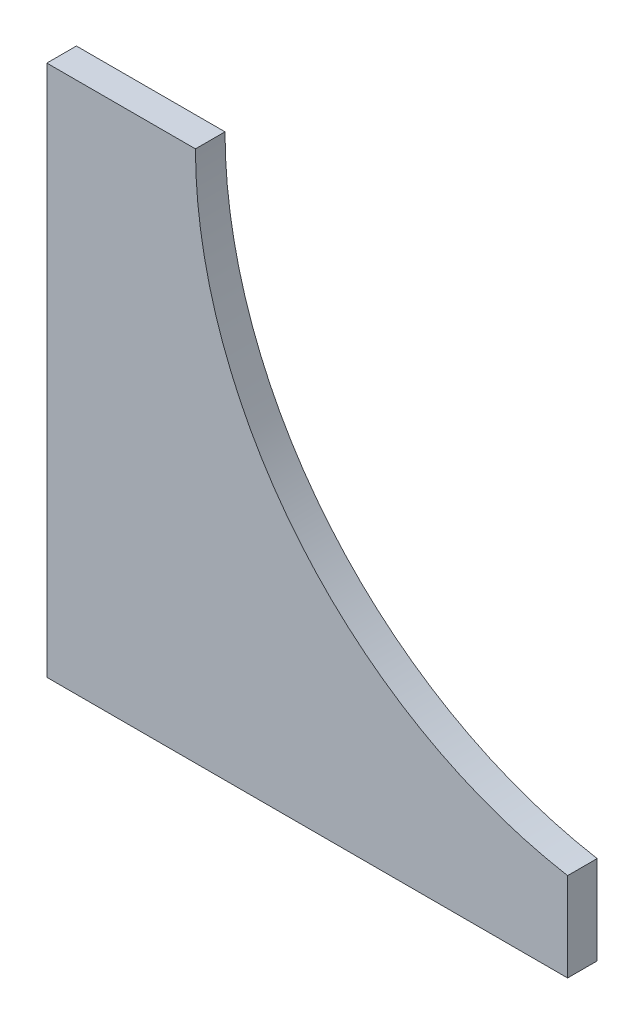
from build123d import *

# Parameters (mm, degrees)
SALIENTE_EXTRUIR1_DEPTH = 10


with BuildPart() as part:
    # Croquis1 → Saliente-Extruir1 (new body)
    with BuildSketch(Plane.XY):
        with BuildLine():
            Line((-56.28767918, 206.147542534), (-56.28767918, 26.147542534))
            Line((-56.28767918, 26.147542534), (119.918563855, 26.147542534))
            Line((119.918563855, 26.147542534), (119.918563855, 56.147542534))
            ThreePointArc((119.918563855, 56.147542534), (29.650497915, 108.223742781), (-6.003166727, 206.147542534))
            Line((-6.003166727, 206.147542534), (-56.28767918, 206.147542534))
        make_face()
    extrude(amount=SALIENTE_EXTRUIR1_DEPTH)


solid = part.part
